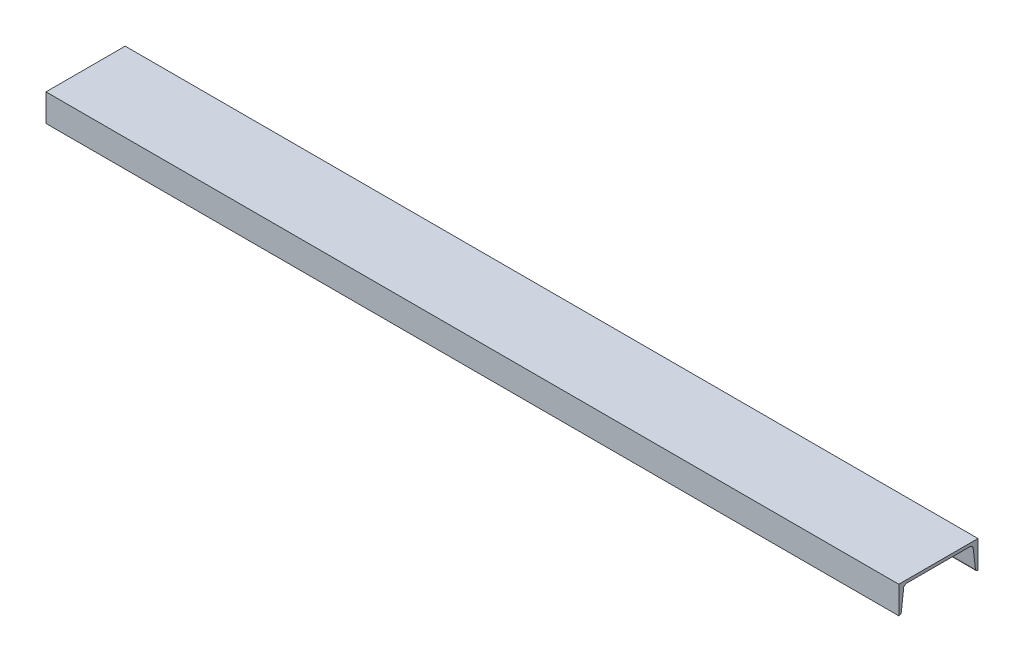
from build123d import *

# Parameters (mm, degrees)
EXTRUDE_1_DEPTH = 2800


with BuildPart() as part:
    # Эскиз2 → Бобышка-Вытянуть1 (new body)
    with BuildSketch(Plane(origin=(0, 0, 0), x_dir=(0, 0, -1), z_dir=(1, 0, 0))):
        with BuildLine():
            Line((130, 0), (-130, 0))
            Line((-130, 0), (-130, -90))
            Line((-130, -90), (-128.678333405, -90))
            ThreePointArc((-128.678333405, -90), (-124.028136062, -88.232175902), (-121.726718983, -83.821618477))
            Line((-121.726718983, -83.821618477), (-113.795983048, -16.720622289))
            ThreePointArc((-113.795983048, -16.720622289), (-108.696165424, -11.795261413), (-101.83727659, -10))
            Line((-101.83727659, -10), (101.83727659, -10))
            ThreePointArc((101.83727659, -10), (108.696165424, -11.795261413), (113.795983048, -16.720622289))
            Line((113.795983048, -16.720622289), (121.726718983, -83.821618477))
            ThreePointArc((121.726718983, -83.821618477), (124.028136062, -88.232175902), (128.678333405, -90))
            Line((128.678333405, -90), (130, -90))
            Line((130, -90), (130, 0))
        make_face()
    extrude(amount=EXTRUDE_1_DEPTH)


solid = part.part
